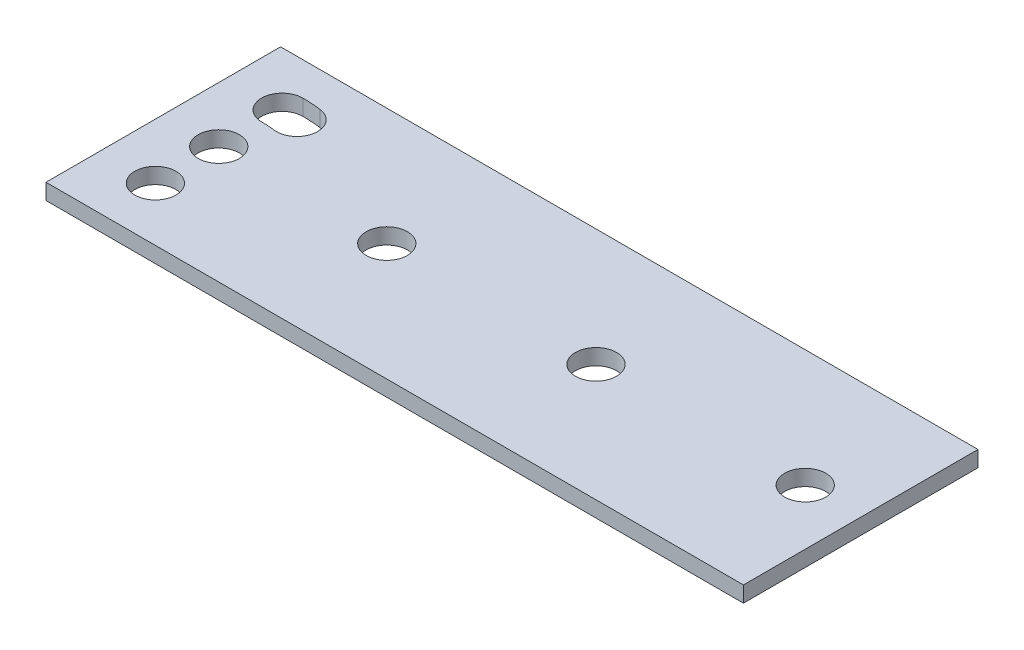
from build123d import *

# Parameters (mm, degrees)
SZKIC1_W                    = 220
SZKIC1_H                    = 74
SZKIC1_R                    = 6.5
DODANIE_WYCI_GNI_CIE1_DEPTH = 5


with BuildPart() as part:
    # Szkic1 → Dodanie-wyciągnięcie1 (new body)
    with BuildSketch(Plane(origin=(0, 0, 0), x_dir=(1, 0, 0), z_dir=(0, 1, 0))):
        with Locations((110, 37)):
            Rectangle(SZKIC1_W, SZKIC1_H)
        with Locations(Location((17.5, 37, 0), (0, 0, 270))):
            Circle(SZKIC1_R, mode=Mode.SUBTRACT)
        with Locations(Location((70.5, 37, 0), (0, 0, 270))):
            Circle(SZKIC1_R, mode=Mode.SUBTRACT)
        with Locations(Location((202.5, 37, 0), (0, 0, 90))):
            Circle(SZKIC1_R, mode=Mode.SUBTRACT)
        with Locations(Location((136.5, 37, 0), (0, 0, 90))):
            Circle(SZKIC1_R, mode=Mode.SUBTRACT)
        with Locations(Location((17.5, 17, 0), (0, 0, 270))):
            Circle(SZKIC1_R, mode=Mode.SUBTRACT)
        with BuildLine():
            ThreePointArc((17.5, 63.5), (11, 57), (17.5, 50.5))
            ThreePointArc((17.5, 50.5), (19.59786757, 50.434248184), (21.6875, 50.237250845))
            ThreePointArc((21.6875, 50.237250845), (28.949018821, 55.873769666), (23.3125, 63.135288487))
            ThreePointArc((23.3125, 63.135288487), (20.411965433, 63.408732555), (17.5, 63.5))
        make_face(mode=Mode.SUBTRACT)
    extrude(amount=DODANIE_WYCI_GNI_CIE1_DEPTH)


solid = part.part
